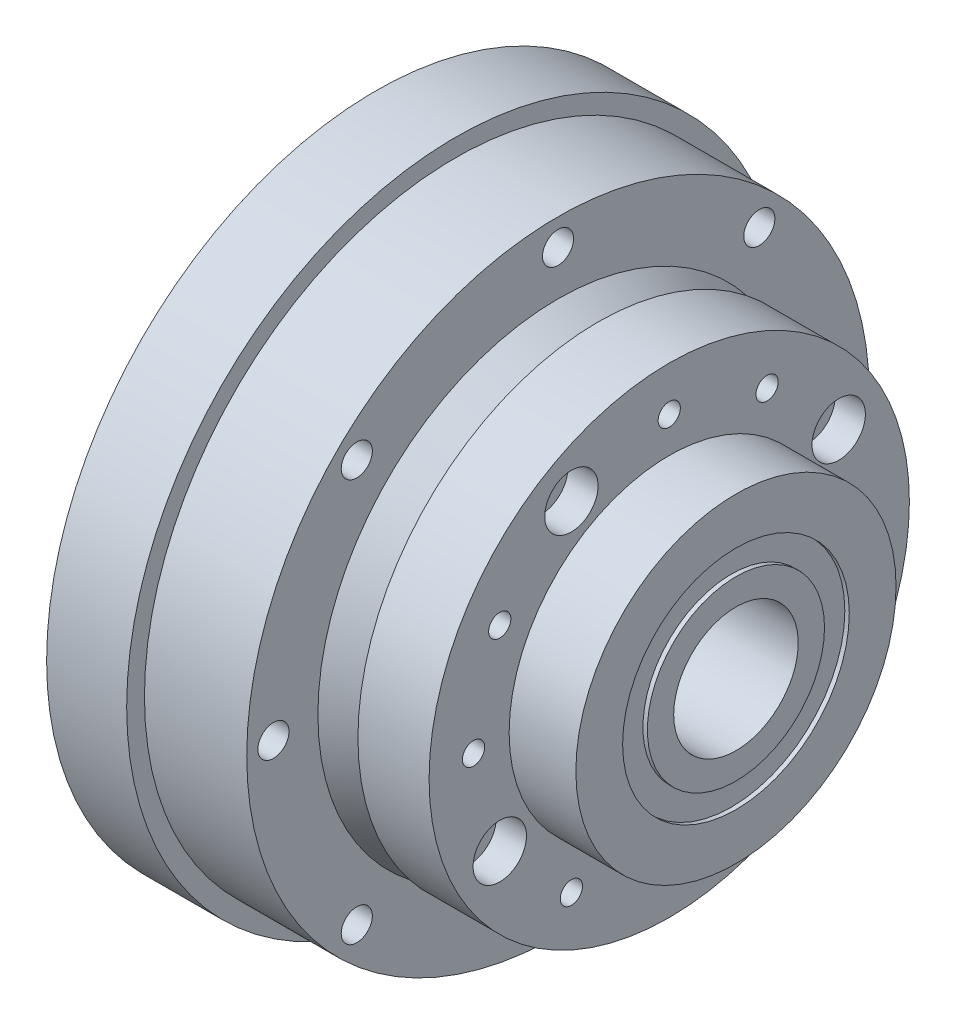
from build123d import *

# Parameters (mm, degrees)
CUT_EXTRUDE_1_REACH      = 68.168
SKETCH_5_R               = 1.75
PATTERN_CIRCULAR_2_COUNT = 8
PATTERN_CIRCULAR_3_COUNT = 2
PATTERN_CIRCULAR_3_ANGLE = 30
SKETCH_9_R               = 18
SKETCH_9_R_2             = 10
EXTRUDE_1_DEPTH          = 5.5
PATTERN_CIRCULAR_4_COUNT = 3
SKETCH_12_R              = 12.742570665
SKETCH_12_R_2            = 9.958698881
CUT_EXTRUDE_2_DEPTH      = 0.5
CUT_EXTRUDE_START        = -0.5
SKETCH_13_R              = 11.804980978
SKETCH_13_R_2            = 10
CUT_EXTRUDE_3_DEPTH      = 0.5
PATTERN_CIRCULAR_5_COUNT = 4
PATTERN_CIRCULAR_6_COUNT = 4


with BuildPart() as part:
    # 草图1 → 旋转1 (revolve)
    with BuildSketch(Plane.XY, mode=Mode.PRIVATE) as revolve_1_sk:
        Polygon((0, 7), (0, 10), (12, 10), (12, 37), (21, 37), (21, 35), (32.5, 35), (32.5, 27), (37, 24.401923789), (37, 27), (45, 27), (45, 18), (52.5, 18), (52.5, 7), align=None)
    revolve(revolve_1_sk.sketch.rotate(Axis((-65.200779727, 0, 0), (1, 0, 0)), 90), axis=Axis((-65.200779727, 0, 0), (1, 0, 0)))

    # 草图5 → 切除-拉伸1 (cut, up to next)
    with BuildSketch(Plane.ZY.offset(-12), mode=Mode.PRIVATE) as cut_extrude_1_sk1:
        with Locations((0, 32)):
            Circle(SKETCH_5_R)
    cut_extrude_1_tool1 = extrude(cut_extrude_1_sk1.sketch, amount=-CUT_EXTRUDE_1_REACH, mode=Mode.PRIVATE) & part.part
    cut_extrude_1 = cut_extrude_1_tool1.solids().sort_by_distance((12, 32, 0))[0]
    add(cut_extrude_1, mode=Mode.SUBTRACT)

    # 阵列(圆周)2: 切除-拉伸1 ×8 about axis
    pattern_circular_2_axis = Axis((0, 0, 0), (1, 0, 0))
    for i in range(1, PATTERN_CIRCULAR_2_COUNT):
        add(cut_extrude_1.rotate(pattern_circular_2_axis, i * 360 / PATTERN_CIRCULAR_2_COUNT), mode=Mode.SUBTRACT)

    # 草图7 → M3 螺纹孔2 (revolve, cut)
    with BuildSketch(Plane(origin=(45, 22, 0), x_dir=(0, 0, -1), z_dir=(0, 1, 0))):
        Polygon((0, 0), (0, 12.251075774), (1.25, 11.5), (1.25, 0), align=None)
    hole_wizard_m3_2 = revolve(axis=Axis((51.35, 22, 0), (-1, 0, 0)), mode=Mode.SUBTRACT)

    # 阵列(圆周)3: M3 螺纹孔2 ×2 about axis
    pattern_circular_3_axis = Axis((52.5, 0, 0), (-1, 0, 0))
    for i in range(1, PATTERN_CIRCULAR_3_COUNT):
        add(hole_wizard_m3_2.rotate(pattern_circular_3_axis, i * PATTERN_CIRCULAR_3_ANGLE / (PATTERN_CIRCULAR_3_COUNT - 1)), mode=Mode.SUBTRACT)

    # 草图9 → 凸台-拉伸1 (add)
    with BuildSketch(Plane.ZY.offset(-12)):
        Circle(SKETCH_9_R)
        Circle(SKETCH_9_R_2, mode=Mode.SUBTRACT)
    extrude(amount=EXTRUDE_1_DEPTH)

    # 草图10 → M3 螺纹孔3 (revolve, cut)
    with BuildSketch(Plane(origin=(2.5, 10, 0), x_dir=(0, 0, 1), z_dir=(1, 0, 0))):
        Polygon((0, 0), (0, 7.251075774), (1.25, 6.5), (1.25, 0), align=None)
    hole_wizard_m3_3 = revolve(axis=Axis((2.5, 16.35, 0), (0, -1, 0)), mode=Mode.SUBTRACT)

    # 阵列(圆周)4: M3 螺纹孔3 ×3 about axis
    pattern_circular_4_axis = Axis((52.5, 0, 0), (-1, 0, 0))
    for i in range(1, PATTERN_CIRCULAR_4_COUNT):
        add(hole_wizard_m3_3.rotate(pattern_circular_4_axis, i * 360 / PATTERN_CIRCULAR_4_COUNT), mode=Mode.SUBTRACT)

    # 草图12 → 切除-拉伸2 (cut)
    with BuildSketch(Plane(origin=(52.5, 0, 0), x_dir=(0, 0, -1), z_dir=(1, 0, 0))):
        Circle(SKETCH_12_R)
        Circle(SKETCH_12_R_2, mode=Mode.SUBTRACT)
    extrude(amount=-CUT_EXTRUDE_2_DEPTH, mode=Mode.SUBTRACT)

    # 草图13 → 切除-拉伸3 (cut)
    with BuildSketch(Plane.ZY.offset(-6.5).offset(CUT_EXTRUDE_START)):
        Circle(SKETCH_13_R)
        Circle(SKETCH_13_R_2, mode=Mode.SUBTRACT)
    extrude(amount=CUT_EXTRUDE_3_DEPTH, mode=Mode.SUBTRACT)

    # 阵列(圆周)5: M3 螺纹孔2 ×4 about axis
    pattern_circular_5_axis = Axis((0, 0, 0), (1, 0, 0))
    for i in range(1, PATTERN_CIRCULAR_5_COUNT):
        add(hole_wizard_m3_2.rotate(pattern_circular_5_axis, i * 360 / PATTERN_CIRCULAR_5_COUNT), mode=Mode.SUBTRACT)

    # 阵列(圆周)5 copy 1 sketch → 阵列(圆周)5 copy 1 (revolve, cut)
    with BuildSketch(Plane(origin=(45, 11, 19.052558883), x_dir=(0, 0.866025403784438, -0.5000000000000011), z_dir=(0, 0.5000000000000011, 0.866025403784438))):
        Polygon((0, 0), (0, 12.251075774), (1.25, 11.5), (1.25, 0), align=None)
    revolve(axis=Axis((51.35, 11, 19.052558883), (-1, 0, 0)), mode=Mode.SUBTRACT)

    # 阵列(圆周)5 copy 2 sketch → 阵列(圆周)5 copy 2 (revolve, cut)
    with BuildSketch(Plane(origin=(45, -19.052558883, 11), x_dir=(0, 0.5000000000000012, 0.8660254037844379), z_dir=(0, -0.8660254037844379, 0.5000000000000012))):
        Polygon((0, 0), (0, 12.251075774), (1.25, 11.5), (1.25, 0), align=None)
    revolve(axis=Axis((51.35, -19.052558883, 11), (-1, 0, 0)), mode=Mode.SUBTRACT)

    # 阵列(圆周)5 copy 3 sketch → 阵列(圆周)5 copy 3 (revolve, cut)
    with BuildSketch(Plane(origin=(45, -11, -19.052558883), x_dir=(0, -0.8660254037844379, 0.5000000000000012), z_dir=(0, -0.5000000000000012, -0.8660254037844379))):
        Polygon((0, 0), (0, 12.251075774), (1.25, 11.5), (1.25, 0), align=None)
    revolve(axis=Axis((51.35, -11, -19.052558883), (-1, 0, 0)), mode=Mode.SUBTRACT)

    # 草图14 → 打孔尺寸(%根据)内六角圆柱头螺钉的类型1 (revolve, cut)
    with BuildSketch(Plane(origin=(45, 11, -19.052558883), x_dir=(0, 0, -1), z_dir=(0, 1, 0))):
        Polygon((0, 0), (0, 16.521463052), (1.7, 15.5), (1.7, 3.4), (3, 3.4), (3, 0), align=None)
    hole_wizard_1 = revolve(axis=Axis((51.35, 11, -19.052558883), (-1, 0, 0)), mode=Mode.SUBTRACT)

    # 阵列(圆周)6: 打孔尺寸(%根据)内六角圆柱头螺钉的类型1 ×4 about axis
    pattern_circular_6_axis = Axis((0, 0, 0), (1, 0, 0))
    for i in range(1, PATTERN_CIRCULAR_6_COUNT):
        add(hole_wizard_1.rotate(pattern_circular_6_axis, i * 360 / PATTERN_CIRCULAR_6_COUNT), mode=Mode.SUBTRACT)


solid = part.part
